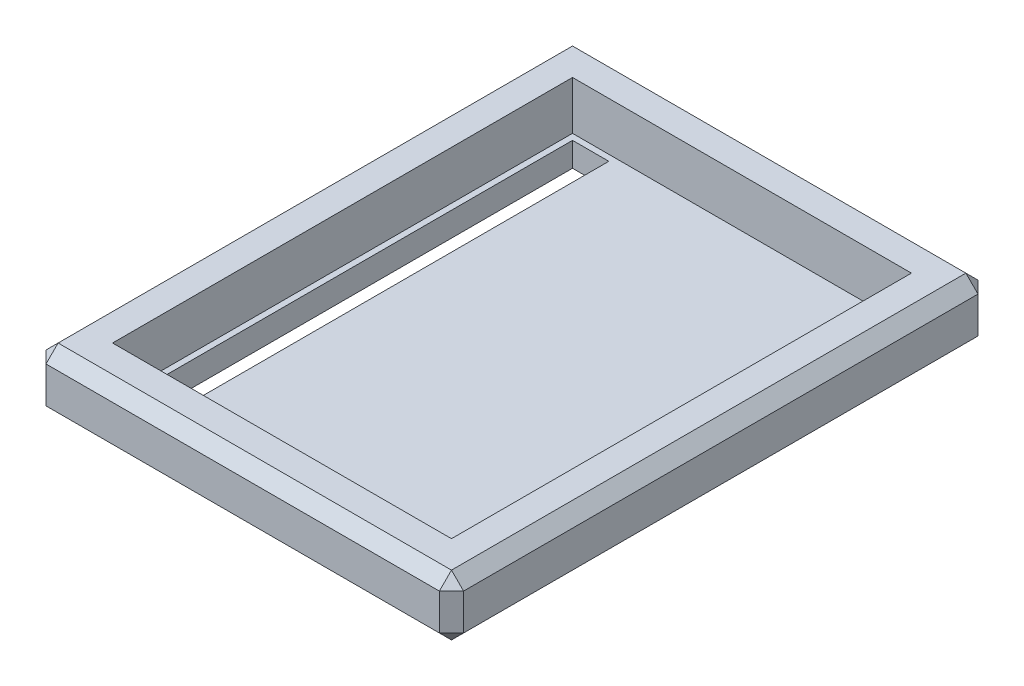
from build123d import *

# Parameters (mm, degrees)
SKETCH1_W           = 711.2
SKETCH1_H           = 965.2
SKETCH1_W_2         = 76.2
SKETCH1_H_2         = 939.8
BOSS_EXTRUDE1_DEPTH = 50.8
SKETCH2_W           = 711.2
SKETCH2_H           = 127
BOSS_EXTRUDE2_DEPTH = 82.55
SKETCH3_W           = 711.2
SKETCH3_H           = 127
BOSS_EXTRUDE3_DEPTH = 82.55
SKETCH4_W           = 1130.3
SKETCH4_H           = 127
BOSS_EXTRUDE4_DEPTH = 82.55
SKETCH5_W           = 1130.3
SKETCH5_H           = 127
BOSS_EXTRUDE5_DEPTH = 82.55
CHAMFER1_SIZE       = 25.4


with BuildPart() as part:
    # Sketch1 → Boss-Extrude1 (new body)
    with BuildSketch(Plane(origin=(0, 0, 0), x_dir=(1, 0, 0), z_dir=(0, 1, 0))):
        Rectangle(SKETCH1_W, SKETCH1_H)
        with Locations((-304.8, 0)):
            Rectangle(SKETCH1_W_2, SKETCH1_H_2, mode=Mode.SUBTRACT)
        with Locations((304.8, 0)):
            Rectangle(SKETCH1_W_2, SKETCH1_H_2, mode=Mode.SUBTRACT)
    extrude(amount=BOSS_EXTRUDE1_DEPTH)

    # Sketch2 → Boss-Extrude2 (add)
    with BuildSketch(Plane.XY.offset(482.6)):
        with Locations((0, 88.9)):
            Rectangle(SKETCH2_W, SKETCH2_H)
    extrude(amount=BOSS_EXTRUDE2_DEPTH)

    # Sketch3 → Boss-Extrude3 (add)
    with BuildSketch(Plane(origin=(0, 0, -482.6), x_dir=(-1, 0, 0), z_dir=(0, 0, -1))):
        with Locations((0, 88.9)):
            Rectangle(SKETCH3_W, SKETCH3_H)
    extrude(amount=BOSS_EXTRUDE3_DEPTH)

    # Sketch4 → Boss-Extrude4 (add)
    with BuildSketch(Plane(origin=(355.6, 0, 0), x_dir=(0, 0, -1), z_dir=(1, 0, 0))):
        with Locations((0, 88.9)):
            Rectangle(SKETCH4_W, SKETCH4_H)
    extrude(amount=BOSS_EXTRUDE4_DEPTH)

    # Sketch5 → Boss-Extrude5 (add)
    with BuildSketch(Plane.ZY.offset(355.6)):
        with Locations((0, 88.9)):
            Rectangle(SKETCH5_W, SKETCH5_H)
    extrude(amount=BOSS_EXTRUDE5_DEPTH)

    # Chamfer1
    chamfer1_edges = [part.edges().sort_by_distance(p)[0] for p in [
        (0, 25.4, 565.15),
        (0, 152.4, 565.15),
        (0, 25.4, -565.15),
        (0, 152.4, -565.15),
        (438.15, 88.9, 565.15),
        (438.15, 25.4, 0),
        (438.15, 88.9, -565.15),
        (438.15, 152.4, 0),
        (-438.15, 88.9, -565.15),
        (-438.15, 25.4, 0),
        (-438.15, 88.9, 565.15),
        (-438.15, 152.4, 0),
    ]]
    chamfer(chamfer1_edges, length=CHAMFER1_SIZE)


solid = part.part
